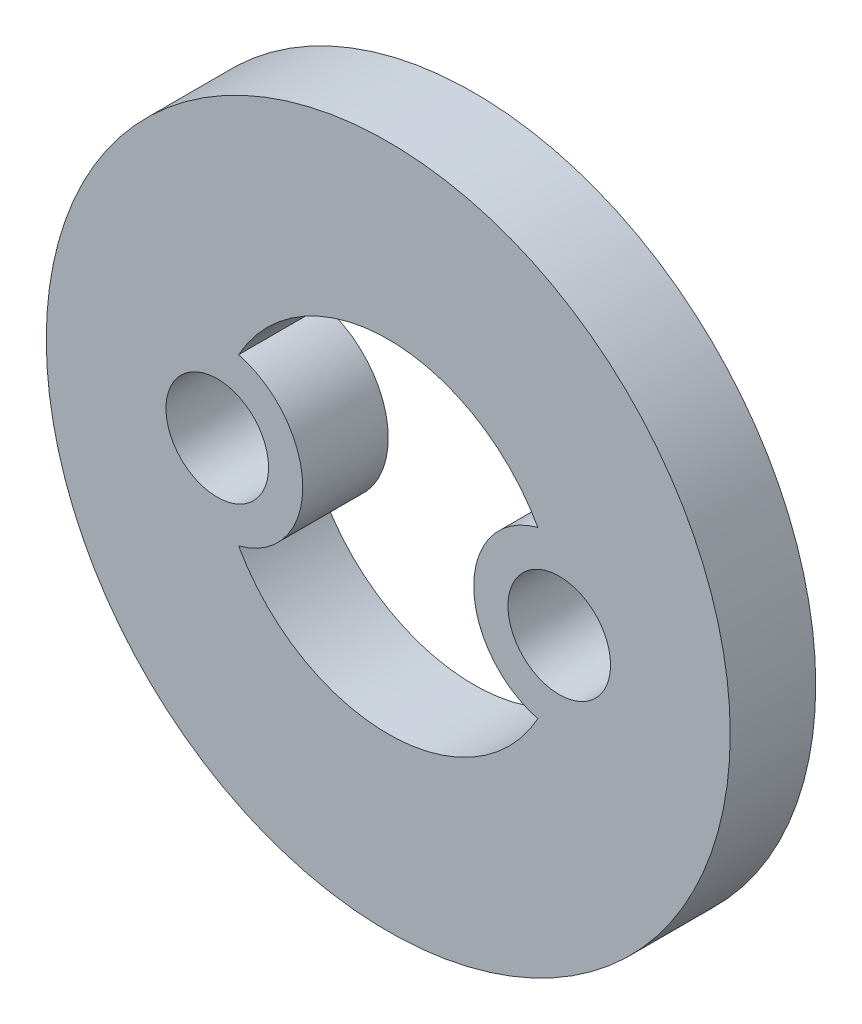
from build123d import *

# Parameters (mm, degrees)
CROQUIS1_R              = 20
CROQUIS1_R_2            = 3
SALIENTE_EXTRUIR1_DEPTH = 5


with BuildPart() as part:
    # Croquis1 → Saliente-Extruir1 (new body)
    with BuildSketch(Plane.XY):
        Circle(CROQUIS1_R)
        with Locations((10, 0)):
            Circle(CROQUIS1_R_2, mode=Mode.SUBTRACT)
        with Locations((-10, 0)):
            Circle(CROQUIS1_R_2, mode=Mode.SUBTRACT)
        with BuildLine():
            ThreePointArc((8.75, 4.841229183), (0, 10), (-8.75, 4.841229183))
            ThreePointArc((-8.75, 4.841229183), (-5, 0), (-8.75, -4.841229183))
            ThreePointArc((-8.75, -4.841229183), (0, -10), (8.75, -4.841229183))
            ThreePointArc((8.75, -4.841229183), (5, 0), (8.75, 4.841229183))
        make_face(mode=Mode.SUBTRACT)
    extrude(amount=SALIENTE_EXTRUIR1_DEPTH)


solid = part.part
